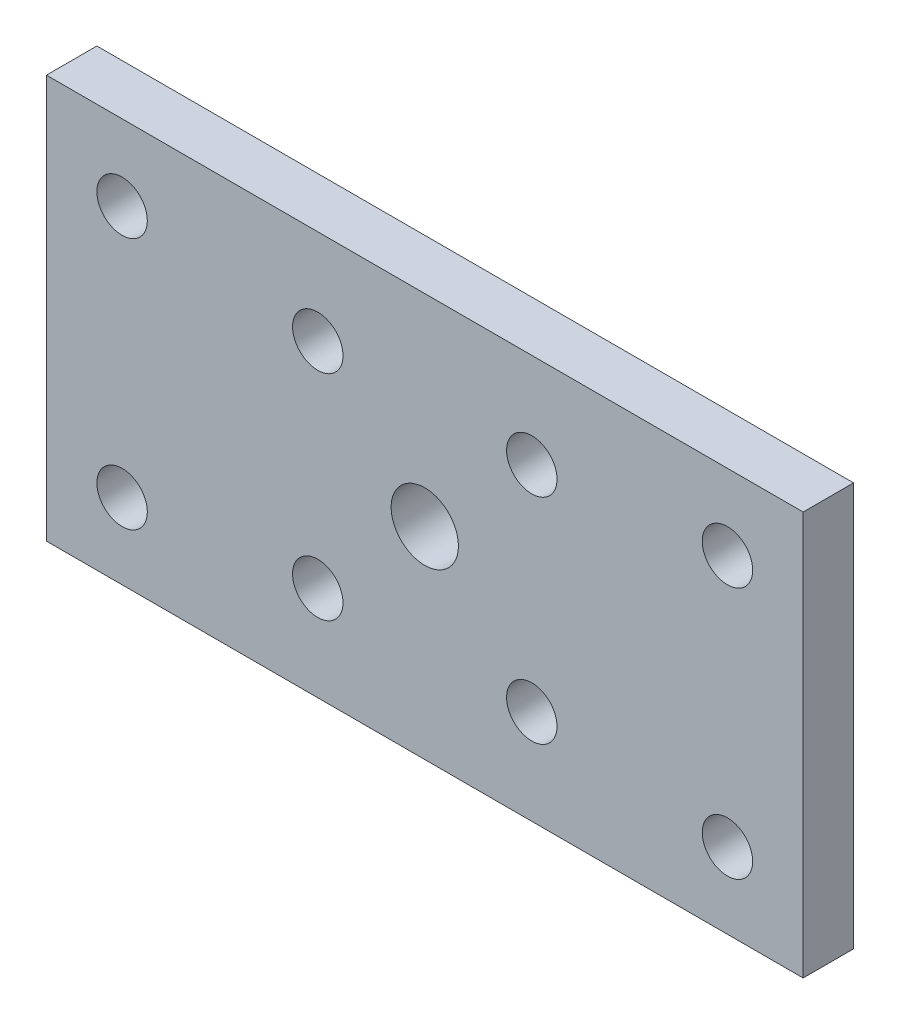
from build123d import *

# Parameters (mm, degrees)
MODEL_R                 = 1.5
MODEL_R_2               = 2
SALIENTE_EXTRUIR1_DEPTH = 3


with BuildPart() as part:
    # Model → Saliente-Extruir1 (new body)
    with BuildSketch(Plane.XY):
        Polygon((92.985593985, 229.537066641), (137.985593985, 229.537057995), (137.985593985, 205.537057995), (92.985593985, 205.537066641), align=None)
        with Locations((109.121632955, 223.901023349)):
            Circle(MODEL_R, mode=Mode.SUBTRACT)
        with Locations((121.849555016, 211.173101287)):
            Circle(MODEL_R, mode=Mode.SUBTRACT)
        with Locations((121.849555016, 223.901023349)):
            Circle(MODEL_R, mode=Mode.SUBTRACT)
        with Locations((109.121632955, 211.173101287)):
            Circle(MODEL_R, mode=Mode.SUBTRACT)
        with Locations((115.485593985, 217.537062318)):
            Circle(MODEL_R_2, mode=Mode.SUBTRACT)
        with Locations((97.485593985, 225.037066641)):
            Circle(MODEL_R, mode=Mode.SUBTRACT)
        with Locations((97.485593985, 210.037066641)):
            Circle(MODEL_R, mode=Mode.SUBTRACT)
        with Locations((133.485593985, 225.037057995)):
            Circle(MODEL_R, mode=Mode.SUBTRACT)
        with Locations((133.485593985, 210.037057995)):
            Circle(MODEL_R, mode=Mode.SUBTRACT)
    extrude(amount=SALIENTE_EXTRUIR1_DEPTH)


solid = part.part
